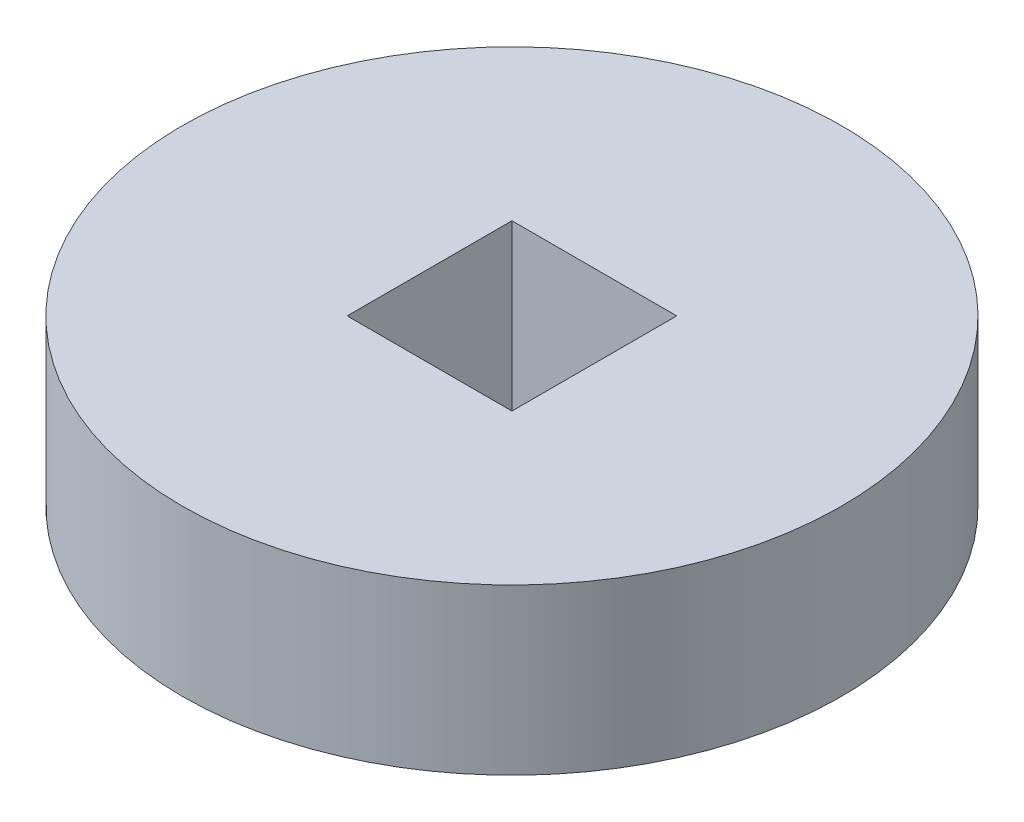
from build123d import *

# Parameters (mm, degrees)
BELT_PULLEY_R       = 12.7
BELT_PULLEY_W       = 6.35
BELT_PULLEY_H       = 6.35
BOSS_EXTRUDE1_DEPTH = 6.35


with BuildPart() as part:
    # Belt Pulley → Boss-Extrude1 (new body)
    with BuildSketch(Plane(origin=(0, 0, 0), x_dir=(1, 0, 0), z_dir=(0, 1, 0))):
        with Locations(Location((0, 0, 0), (0, 0, 270))):
            Circle(BELT_PULLEY_R)
        Rectangle(BELT_PULLEY_W, BELT_PULLEY_H, mode=Mode.SUBTRACT)
    extrude(amount=BOSS_EXTRUDE1_DEPTH)


solid = part.part
